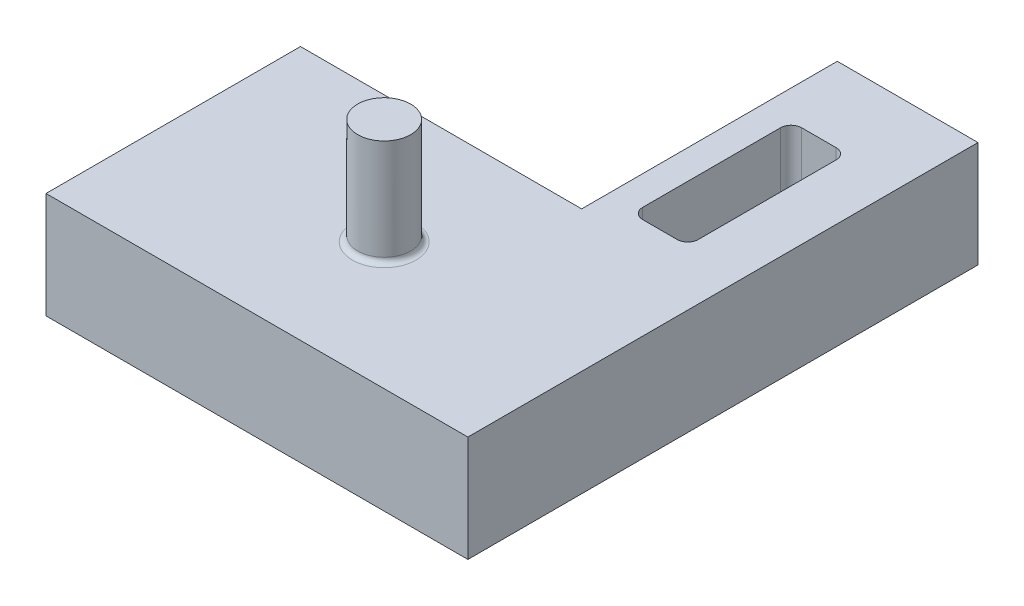
from build123d import *

# Parameters (mm, degrees)
BOSS_EXTRUDE1_DEPTH  = 10
FILLET2_R            = 1
FILLET2_OF_MIRROR1_R = 1
CUT_EXTRUDE1_DEPTH   = 81.635062113
FILLET3_R            = 1
SKETCH5_R            = 2.5
BOSS_EXTRUDE2_DEPTH  = 10
FILLET1_R            = 0.5
SKETCH6_W            = 39.78759817
SKETCH6_H            = 34
CUT_EXTRUDE2_DEPTH   = 10


with BuildPart() as part:
    # Sketch2 → Boss-Extrude1 (new body)
    with BuildSketch(Plane(origin=(0, 0, 0), x_dir=(1, 0, 0), z_dir=(0, 1, 0))):
        Polygon((-19.893799085, 77.5), (0, 77.5), (0, 75.5), (-2.625, 75.5), (-2.625, 73), (-2.625, 63), (-2.625, 60.5), (0, 60.5), (0, 60.375), (0, 2.5), (-2.625, 2.5), (-2.625, 0), (-2.625, -10), (-2.625, -12.5), (0, -12.5), (0, -14.5), (-19.893799085, -14.5), align=None)
    boss_extrude1 = extrude(amount=BOSS_EXTRUDE1_DEPTH)

    # Fillet2
    fillet2_edges = [part.edges().sort_by_distance(p)[0] for p in [
        (-2.625, 5, 12.5),
        (-2.625, 5, -2.5),
        (-2.625, 5, -60.5),
        (-2.625, 5, -75.5),
    ]]
    fillet(fillet2_edges, radius=FILLET2_R)

    # Mirror1: Boss-Extrude1 across Right Plane
    add(boss_extrude1.mirror(Plane(origin=(0, 0, 0), x_dir=(0, 0, -1), z_dir=(1, 0, 0))))

    # Fillet2 of Mirror1
    fillet2_of_mirror1_edges = [part.edges().sort_by_distance(p)[0] for p in [
        (2.625, 5, 12.5),
        (2.625, 5, -2.5),
        (2.625, 5, -60.5),
        (2.625, 5, -75.5),
    ]]
    fillet(fillet2_of_mirror1_edges, radius=FILLET2_OF_MIRROR1_R)

    # Sketch4 → Cut-Extrude1 (cut, through all)
    with BuildSketch(Plane(origin=(0, 0, 0), x_dir=(1, 0, 0), z_dir=(0, 1, 0))):
        Polygon((-14.625, 15), (-14.625, 5), (-14.625, 2.5), (-12, 2.5), (-9.375, 2.5), (-9.375, 5), (-9.375, 15), (-9.375, 17.5), (-12, 17.5), (-14.625, 17.5), align=None)
        Polygon((9.375, 58), (9.375, 48), (9.375, 45.5), (12, 45.5), (14.625, 45.5), (14.625, 48), (14.625, 58), (14.625, 60.5), (12, 60.5), (9.375, 60.5), align=None)
    extrude(amount=CUT_EXTRUDE1_DEPTH, mode=Mode.SUBTRACT)

    # Fillet3
    fillet3_edges = [part.edges().sort_by_distance(p)[0] for p in [
        (-14.625, 5, -17.5),
        (-14.625, 5, -2.5),
        (-9.375, 5, -2.5),
        (-9.375, 5, -17.5),
        (14.625, 5, -60.5),
        (9.375, 5, -60.5),
        (9.375, 5, -45.5),
        (14.625, 5, -45.5),
    ]]
    fillet(fillet3_edges, radius=FILLET3_R)

    # Sketch5 → Boss-Extrude2 (add)
    with BuildSketch(Plane(origin=(0, 10, 0), x_dir=(1, 0, 0), z_dir=(0, 1, 0))):
        with Locations(Location((0, 31.5, 0), (0, 0, 90))):
            Circle(SKETCH5_R)
    extrude(amount=BOSS_EXTRUDE2_DEPTH)

    # Fillet1
    fillet1_edges = [part.edges().sort_by_distance(p)[0] for p in [
        (0, 10, -29),
    ]]
    fillet(fillet1_edges, radius=FILLET1_R)

    # Sketch6 → Cut-Extrude2 (cut)
    with BuildSketch(Plane(origin=(0, 10, 0), x_dir=(1, 0, 0), z_dir=(0, 1, 0))):
        Polygon((19.893799085, 77.5), (19.893799085, 67.609192382), (6.625, 67.609192382), (6.625, 43.5), (-6.625, 43.5), (-19.893799085, 43.5), (-19.893799085, 77.5), (-6.625, 77.5), align=None)
        with Locations((0, 2.5)):
            Rectangle(SKETCH6_W, SKETCH6_H)
    extrude(amount=-CUT_EXTRUDE2_DEPTH, mode=Mode.SUBTRACT)


solid = part.part
